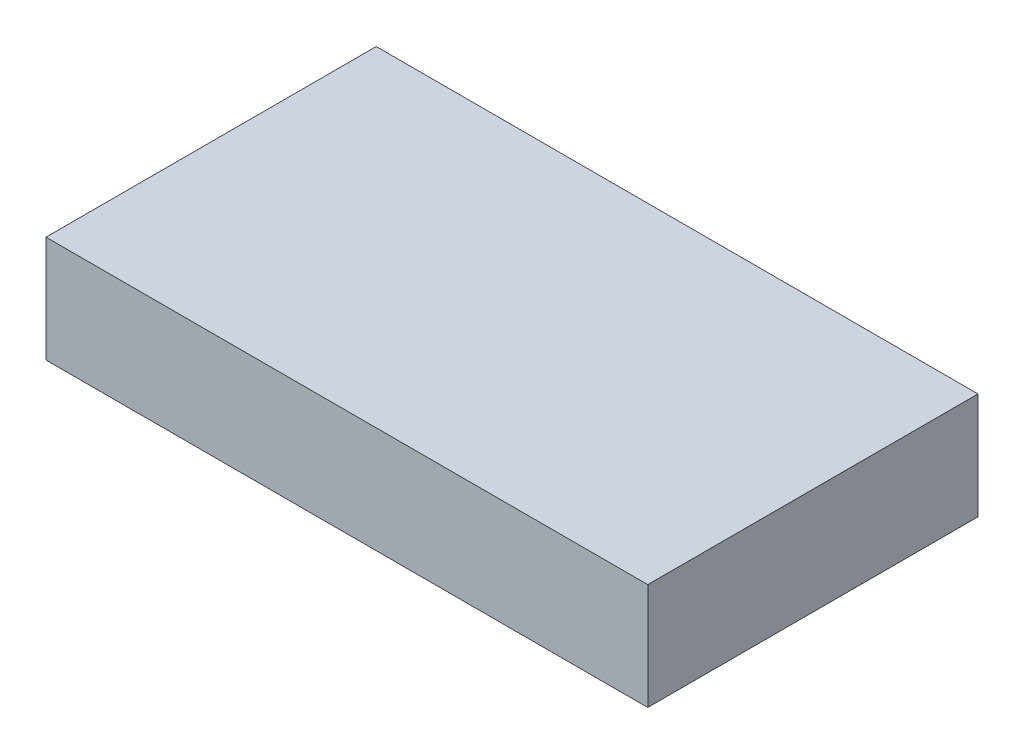
from build123d import *

# Parameters (mm, degrees)
SKETCH1_W           = 41
SKETCH1_H           = 22.5
BOSS_EXTRUDE1_DEPTH = 7.25


with BuildPart() as part:
    # Sketch1 → Boss-Extrude1 (new body)
    with BuildSketch(Plane(origin=(0, 0, 0), x_dir=(1, 0, 0), z_dir=(0, 1, 0))):
        with Locations((0, -1.563421198)):
            Rectangle(SKETCH1_W, SKETCH1_H)
    extrude(amount=BOSS_EXTRUDE1_DEPTH)


solid = part.part
